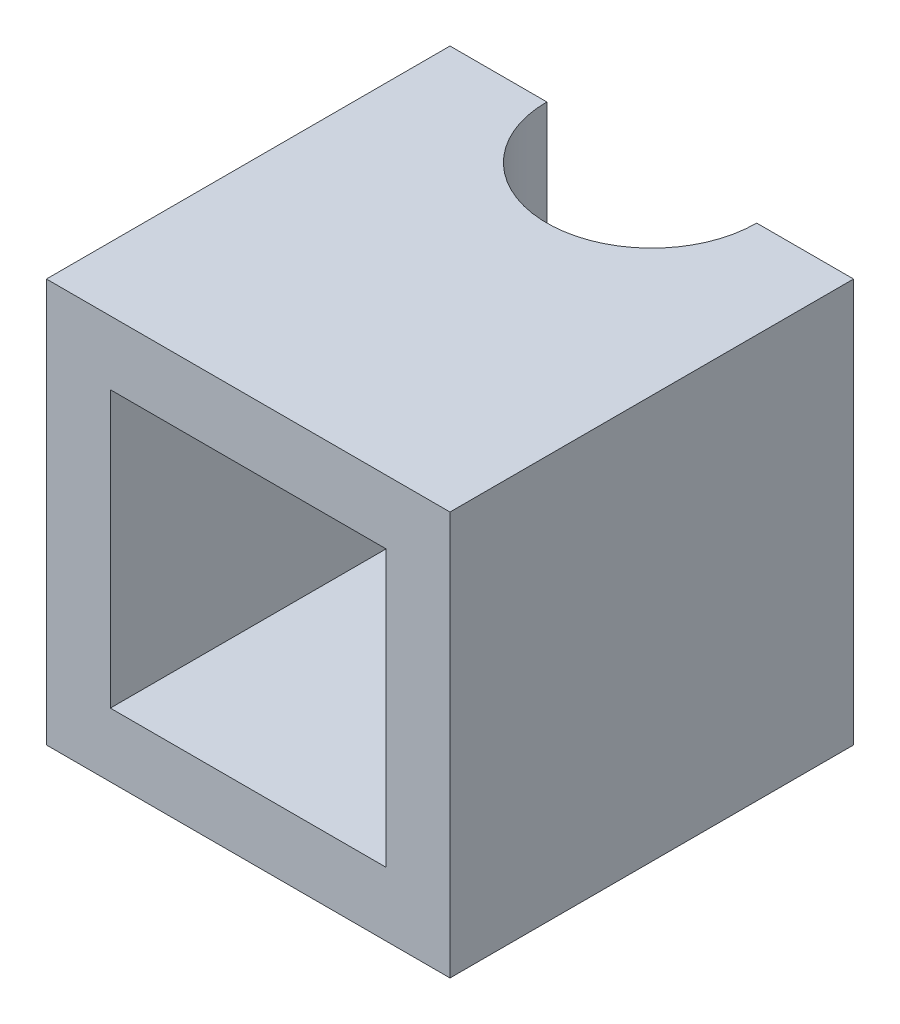
from build123d import *

# Parameters (mm, degrees)
SKETCH1_W           = 30
SKETCH1_H           = 30
SKETCH1_W_2         = 20.5
SKETCH1_H_2         = 20.5
BOSS_EXTRUDE1_DEPTH = 20
SKETCH2_W           = 30
SKETCH2_H           = 30
BOSS_EXTRUDE3_DEPTH = 10
SKETCH4_W           = 1.5
SKETCH4_H           = 3.5
CUT_REVOLVE1_ANGLE  = 180
SKETCH5_W           = 14.323407416
SKETCH5_H           = 3.5
CUT_EXTRUDE2_DEPTH  = 1.5
SKETCH6_W           = 20.5
SKETCH6_H           = 20.5
CUT_EXTRUDE3_DEPTH  = 2


with BuildPart() as part:
    # Sketch1 → Boss-Extrude1 (new body)
    with BuildSketch(Plane.XY):
        Rectangle(SKETCH1_W, SKETCH1_H)
        Rectangle(SKETCH1_W_2, SKETCH1_H_2, mode=Mode.SUBTRACT)
    extrude(amount=BOSS_EXTRUDE1_DEPTH)

    # Sketch2 → Boss-Extrude3 (add)
    with BuildSketch(Plane(origin=(0, 0, 0), x_dir=(-1, 0, 0), z_dir=(0, 0, -1))):
        Rectangle(SKETCH2_W, SKETCH2_H)
    extrude(amount=BOSS_EXTRUDE3_DEPTH)

    # Sketch4 → Cut-Revolve1 (revolve, cut)
    with BuildSketch(Plane(origin=(0, 0, -10), x_dir=(-1, 0, 0), z_dir=(0, 0, -1))):
        Polygon((0, 0), (0, 15), (7.8, 15), (7.8, 8.75), (7.8, 7.65), (7.8, 0), align=None)
        with Locations((11.55, 8.2)):
            Rectangle(SKETCH4_W, SKETCH4_H)
    cut_revolve1 = revolve(axis=Axis((0, 0, -10), (0, 1, 0)), revolution_arc=CUT_REVOLVE1_ANGLE, mode=Mode.SUBTRACT)

    # Sketch5 → Cut-Extrude2 (cut)
    with BuildSketch(Plane.XY):
        with Locations((0, 8.2)):
            Rectangle(SKETCH5_W, SKETCH5_H)
    cut_extrude2 = extrude(amount=-CUT_EXTRUDE2_DEPTH, mode=Mode.SUBTRACT)

    # Mirror1: Cut-Revolve1, Cut-Extrude2 across plane
    add(cut_revolve1.mirror(Plane(origin=(0, 0, -10), x_dir=(0, 0, 1), z_dir=(0, -1, 0))), mode=Mode.SUBTRACT)
    add(cut_extrude2.mirror(Plane(origin=(0, 0, -10), x_dir=(0, 0, 1), z_dir=(0, -1, 0))), mode=Mode.SUBTRACT)

    # Sketch6 → Cut-Extrude3 (cut)
    with BuildSketch(Plane.XY):
        Rectangle(SKETCH6_W, SKETCH6_H)
    extrude(amount=-CUT_EXTRUDE3_DEPTH, mode=Mode.SUBTRACT)


solid = part.part
